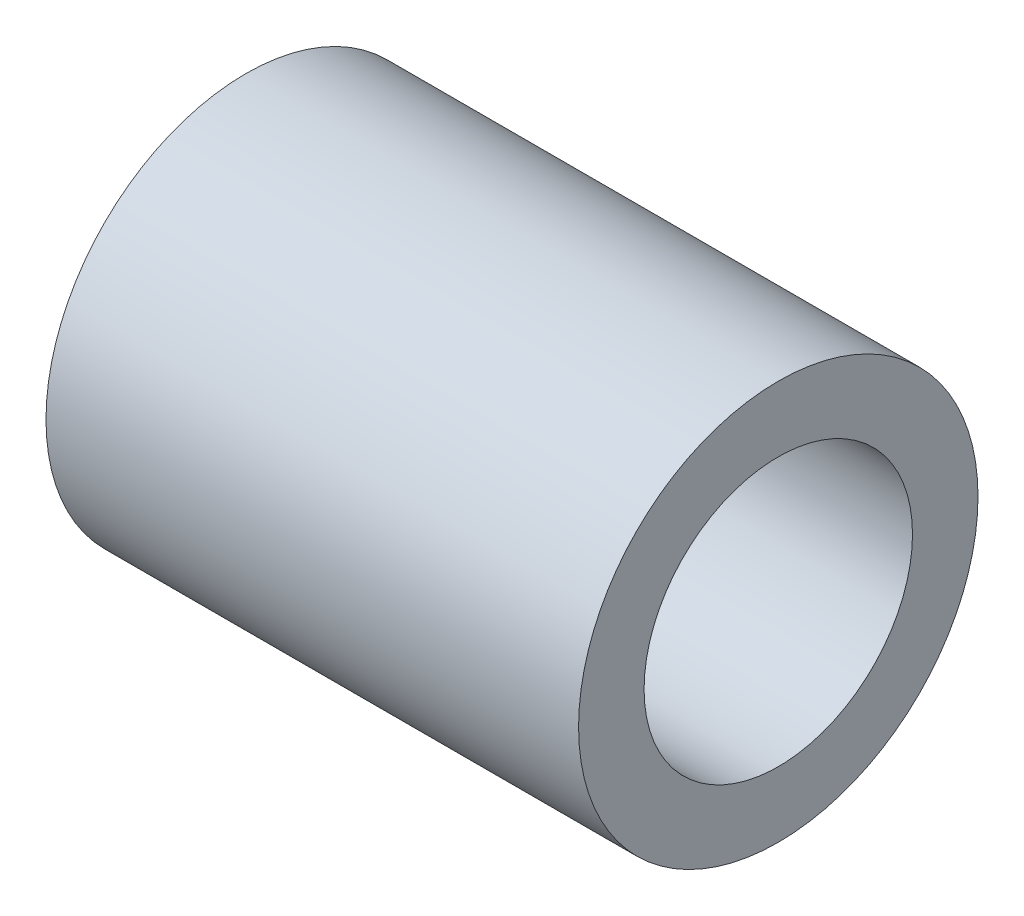
from build123d import *

# Parameters (mm, degrees)
SKETCH1_R           = 4.7625
BOSS_EXTRUDE1_DEPTH = 12.7
SKETCH2_R           = 3.2004
CUT_EXTRUDE1_DEPTH  = 15.875


with BuildPart() as part:
    # Sketch1 → Boss-Extrude1 (new body)
    with BuildSketch(Plane(origin=(0, 0, 0), x_dir=(0, 0, -1), z_dir=(1, 0, 0))):
        Circle(SKETCH1_R)
    extrude(amount=BOSS_EXTRUDE1_DEPTH)

    # Sketch2 → Cut-Extrude1 (cut)
    with BuildSketch(Plane.ZY):
        Circle(SKETCH2_R)
    extrude(amount=-CUT_EXTRUDE1_DEPTH, mode=Mode.SUBTRACT)


solid = part.part
